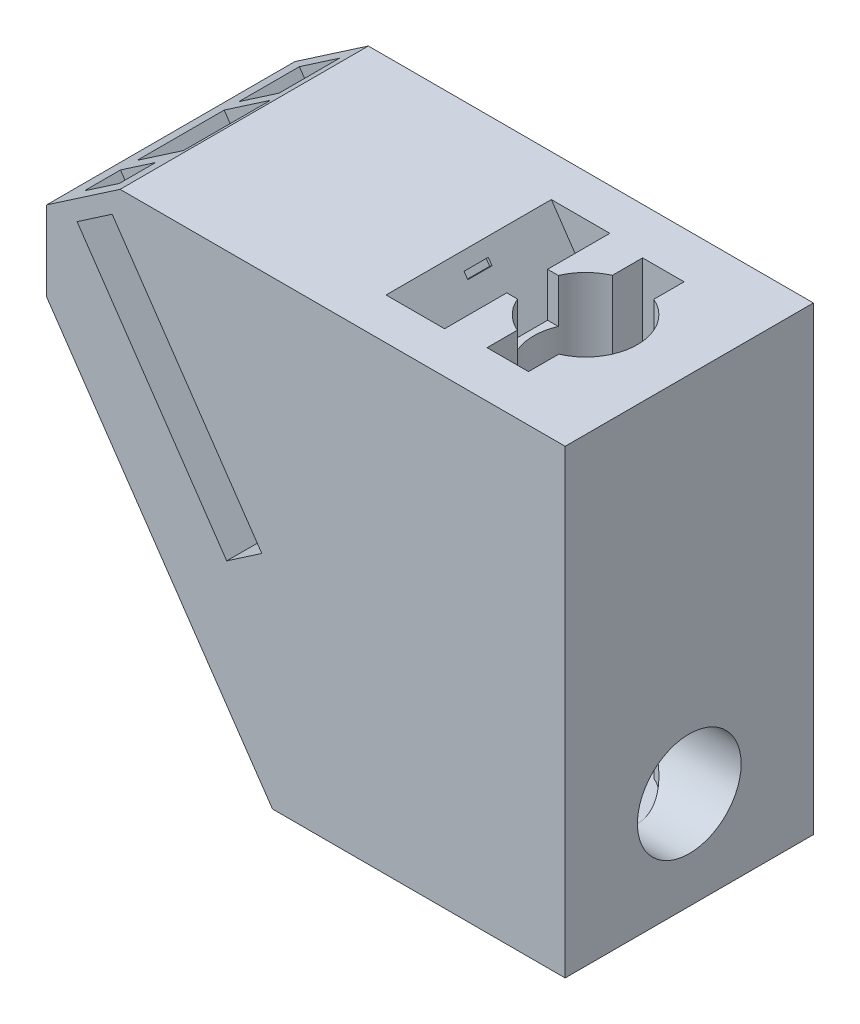
from build123d import *
from build123d.topology import SkipClean

# Parameters (mm, degrees)
BOSS_EXTRUDE1_DEPTH     = 2.5
BOSS_EXTRUDE1_2_DEPTH   = 2.5
BOSS_EXTRUDE2_DEPTH     = 6.35
BOSS_EXTRUDE3_DEPTH     = 6.35
SKETCH4_R               = 3.175
CUT_EXTRUDE1_DEPTH      = 25.4
SKETCH5_R               = 1.5875
CUT_EXTRUDE2_DEPTH      = 25.4
CUT_EXTRUDE3_DEPTH      = 25.4
CUT_EXTRUDE4_REACH      = 43
CUT_EXTRUDE4_END_RADIUS = 3.175
CUT_EXTRUDE5_REACH      = 39.36
SKETCH8_W               = 2.54
SKETCH8_H               = 9.525
SKETCH9_W               = 0.508
SKETCH9_H               = 15.2
BOSS_EXTRUDE4_DEPTH     = 17
BOSS_EXTRUDE5_DEPTH     = 1.016
SKETCH11_W              = 1.176658287
SKETCH11_H              = 2.5
SKETCH11_W_2            = 2.433787944
SKETCH11_H_2            = 15.2
BOSS_EXTRUDE6_DEPTH     = 1.27
CUT_EXTRUDE6_DEPTH      = 38.864332241
BOSS_EXTRUDE7_START     = 2.54
BOSS_EXTRUDE7_DEPTH     = 2.54
BOSS_EXTRUDE8_DEPTH     = 2.54
BOSS_EXTRUDE9_DEPTH     = 0.508
BOSS_EXTRUDE10_DEPTH    = 0.508
CUT_EXTRUDE7_DEPTH      = 3.81
CUT_EXTRUDE8_DEPTH      = 3.81
BOSS_EXTRUDE11_DEPTH    = 3.81
SKETCH21_W              = 1.016
SKETCH21_H              = 1.016
SKETCH21_W_2            = 0.889
BOSS_EXTRUDE12_DEPTH    = 3.302
BOSS_EXTRUDE13_DEPTH    = 3.81


with BuildPart() as part:
    # Sketch1 → Boss-Extrude1 (new body)
    with BuildSketch(Plane.XY):
        Polygon((5.08, 0), (0, 0), (0, 19.141079028), (-1.033059908, 19.141079028), (-3.75575709, 23.125698967), (-8.376397661, 9.077684872), (-11.679025045, 6.820994294), (-21.26996, 20.857160675), (-22.86, 19.770683798), (-22.86, -3.81), (8.89, -3.81), (8.89, 24.384), (5.08, 24.384), align=None)
    extrude(amount=BOSS_EXTRUDE1_DEPTH)



with BuildPart() as body_2:
    # Sketch1 → Boss-Extrude1 2 (new body)
    with BuildSketch(Plane.XY):
        Polygon((-10.069369191, 23.749), (-4.328956497, 23.964566322), (-4.615556201, 24.384), (-16.108492032, 24.384), (-17.03780348, 23.749), align=None)
    extrude(amount=BOSS_EXTRUDE1_2_DEPTH)


with BuildPart() as part_1:
    add(part.part)

    add(body_2.part)  # Boss-Extrude2 merges body 2
    # Sketch2 → Boss-Extrude2 (add)
    with BuildSketch(Plane.XY.offset(2.5)):
        Polygon((-11.679025045, 6.820994294), (-21.26996, 20.857160675), (-22.86, 19.770683798), (-22.86, -3.81), (8.89, -3.81), (8.89, 24.384), (5.08, 24.384), (5.08, 0), (0, 0), (0, 19.141079028), (-1.033059908, 19.141079028), (-3.75575709, 23.125698967), (-8.376397661, 9.077684872), align=None)
        Polygon((-16.108492032, 24.384), (-18.00931945, 23.085161582), (-8.418384495, 9.048995201), (-8.376397661, 9.077684872), (-3.75575709, 23.125698967), (-1.033059908, 19.141079028), (0, 19.141079028), (0, 0), (5.08, 0), (5.08, 24.384), align=None)
    extrude(amount=BOSS_EXTRUDE2_DEPTH)

    # Sketch3 → Boss-Extrude3 (add)
    with BuildSketch(Plane(origin=(0, 0, 0), x_dir=(-1, 0, 0), z_dir=(0, 0, -1))):
        Polygon((-8.89, 24.384), (-8.89, -3.81), (22.86, -3.81), (22.86, 19.770683798), (21.26996, 20.857160675), (11.679025045, 6.820994294), (8.376397661, 9.077684872), (18.00931945, 23.085161582), (16.108492032, 24.384), align=None)
    extrude(amount=BOSS_EXTRUDE3_DEPTH)

    # Sketch4 → Cut-Extrude1 (cut)
    with BuildSketch(Plane(origin=(0, 24.384, 0), x_dir=(1, 0, 0), z_dir=(0, 1, 0))):
        with Locations(Location((2.54, -1.25, 0), (0, 0, 270))):
            Circle(SKETCH4_R)
    extrude(amount=-CUT_EXTRUDE1_DEPTH, mode=Mode.SUBTRACT)

    # Sketch5 → Cut-Extrude2 (cut)
    with BuildSketch(Plane(origin=(0, -1.016, 0), x_dir=(1, 0, 0), z_dir=(0, 1, 0))):
        with Locations(Location((2.54, -1.25, 0), (0, 0, 270))):
            Circle(SKETCH5_R)
    extrude(amount=-CUT_EXTRUDE2_DEPTH, mode=Mode.SUBTRACT)

    # Sketch6 → Cut-Extrude3 (cut)
    with BuildSketch(Plane.XY.offset(8.85)):
        Polygon((-22.86, 16.430904611), (-9.029357481, -3.81), (-22.86, -3.81), align=None)
    extrude(amount=-CUT_EXTRUDE3_DEPTH, mode=Mode.SUBTRACT)

    # Cut-Extrude4: up to this cylinder (the profile starts outside it)
    with SkipClean():  # the faces are left unmerged after this step: merging them gives an invalid solid
        cut_extrude4_end = Plane(origin=(2.54, 2.159, 1.25), z_dir=(0, 1, 0)) * Cylinder(CUT_EXTRUDE4_END_RADIUS, 96.045024, mode=Mode.PRIVATE)
        # Sketch7 → Cut-Extrude4 (cut, up to the surface)
        with BuildSketch(Plane(origin=(8.89, 0, 0), x_dir=(0, 0, -1), z_dir=(1, 0, 0)), mode=Mode.PRIVATE) as cut_extrude4_sk1:
            with BuildLine():
                ThreePointArc((1.925, 2.159), (-1.25, 5.334), (-4.425, 2.159))
                Line((-4.425, 2.159), (1.925, 2.159))
            make_face()
        cut_extrude4_tool1 = extrude(cut_extrude4_sk1.sketch, amount=-CUT_EXTRUDE4_REACH, mode=Mode.PRIVATE) - cut_extrude4_end
        add(cut_extrude4_tool1.solids().sort_by_distance((8.89, 3.506512, 1.25))[0], mode=Mode.SUBTRACT)
        # Sketch7 → Cut-Extrude4 (cut, up to the surface)
        with BuildSketch(Plane(origin=(8.89, 0, 0), x_dir=(0, 0, -1), z_dir=(1, 0, 0)), mode=Mode.PRIVATE) as cut_extrude4_sk2:
            with BuildLine():
                Line((1.925, 2.159), (-4.425, 2.159))
                ThreePointArc((-4.425, 2.159), (-3.49506403, -0.08606403), (-1.25, -1.016))
                ThreePointArc((-1.25, -1.016), (0.99506403, -0.08606403), (1.925, 2.159))
            make_face()
        cut_extrude4_tool2 = extrude(cut_extrude4_sk2.sketch, amount=-CUT_EXTRUDE4_REACH, mode=Mode.PRIVATE) - cut_extrude4_end
        add(cut_extrude4_tool2.solids().sort_by_distance((8.89, 0.811488, 1.25))[0], mode=Mode.SUBTRACT)
        # Sketch7 → Cut-Extrude4 (cut, up to the surface)
        with BuildSketch(Plane(origin=(8.89, 0, 0), x_dir=(0, 0, -1), z_dir=(1, 0, 0)), mode=Mode.PRIVATE) as cut_extrude4_sk3:
            with BuildLine():
                ThreePointArc((1.925, 2.159), (-1.25, 5.334), (-4.425, 2.159))
                Line((-4.425, 2.159), (1.925, 2.159))
            make_face()
        cut_extrude4_tool3 = extrude(cut_extrude4_sk3.sketch, amount=-CUT_EXTRUDE4_REACH, mode=Mode.PRIVATE) - cut_extrude4_end
        add(cut_extrude4_tool3.solids().sort_by_distance((8.89, 3.506512, 1.25))[0], mode=Mode.SUBTRACT)
        # Sketch7 → Cut-Extrude4 (cut, up to the surface)
        with BuildSketch(Plane(origin=(8.89, 0, 0), x_dir=(0, 0, -1), z_dir=(1, 0, 0)), mode=Mode.PRIVATE) as cut_extrude4_sk4:
            with BuildLine():
                Line((1.925, 2.159), (-4.425, 2.159))
                ThreePointArc((-4.425, 2.159), (-3.49506403, -0.08606403), (-1.25, -1.016))
                ThreePointArc((-1.25, -1.016), (0.99506403, -0.08606403), (1.925, 2.159))
            make_face()
        cut_extrude4_tool4 = extrude(cut_extrude4_sk4.sketch, amount=-CUT_EXTRUDE4_REACH, mode=Mode.PRIVATE) - cut_extrude4_end
        add(cut_extrude4_tool4.solids().sort_by_distance((8.89, 0.811488, 1.25))[0], mode=Mode.SUBTRACT)

    # Cut-Extrude5: up to this face of the body (flat: up to its plane)
    cut_extrude5_end = Plane(part_1.part.faces().sort_by_distance((4.72156403, -1.016, 3.43156403))[0])
    # Sketch8 → Cut-Extrude5 (cut, up to the picked face)
    with BuildSketch(Plane(origin=(0, 24.384, 0), x_dir=(1, 0, 0), z_dir=(0, 1, 0)), mode=Mode.PRIVATE) as cut_extrude5_sk1:
        with Locations((2.54, -1.25)):
            Rectangle(SKETCH8_W, SKETCH8_H)
    cut_extrude5_tool1 = split(extrude(cut_extrude5_sk1.sketch, amount=-CUT_EXTRUDE5_REACH, mode=Mode.PRIVATE), bisect_by=cut_extrude5_end, keep=Keep.BOTH, mode=Mode.PRIVATE)
    add(cut_extrude5_tool1.solids().sort_by(Axis((2.54, 24.384, 1.25), (0, -1, 0)))[0], mode=Mode.SUBTRACT)

    # Sketch9 → Boss-Extrude4 (add)
    with BuildSketch(Plane(origin=(-6.894633763, 10.090176515, 0), x_dir=(0.825656845959394, 0.5641726444275594, 0), z_dir=(-0.5641726444275594, 0.825656845959394, 0))):
        with Locations((-5.540648594, -1.25)):
            Rectangle(SKETCH9_W, SKETCH9_H)
        Polygon((-1.794648594, 6.35), (-2.302648594, 6.35), (-2.302648594, 1.6202), (-3.623501238, 1.6202), (-3.623501238, 0.7312), (-1.794648594, 0.7312), align=None)
        Polygon((-1.845501238, -8.85), (-1.845501238, -4.6028), (-3.572648594, -4.6028), (-3.572648594, -5.6188), (-2.683648594, -5.6188), (-2.683648594, -8.85), align=None)
    extrude(amount=BOSS_EXTRUDE4_DEPTH)

    # Sketch10 → Boss-Extrude5 (add)
    with BuildSketch(Plane(origin=(-6.894633763, 10.090176515, 0), x_dir=(0.8256568459593948, 0.5641726444275585, 0), z_dir=(-0.5641726444275585, 0.8256568459593948, 0))):
        Polygon((-5.286648594, -8.85), (-2.683648594, -8.85), (-2.683648594, -5.6188), (-3.572648594, -5.6188), (-3.572648594, -4.6028), (-1.845501238, -4.6028), (-1.845501238, -2.5), (-1.794648594, -2.5), (-1.794648594, 0), (-1.794648594, 0.7312), (-3.623501238, 0.7312), (-3.623501238, 1.6202), (-2.302648594, 1.6202), (-2.302648594, 6.35), (-5.286648594, 6.35), align=None)
    extrude(amount=BOSS_EXTRUDE5_DEPTH)

    # Sketch11 → Boss-Extrude6 (add)
    with BuildSketch(Plane(origin=(-16.485568719, 24.126342896, 0), x_dir=(0.8256568459593935, 0.5641726444275603, 0), z_dir=(-0.5641726444275603, 0.8256568459593935, 0))):
        with Locations((-1.257172095, -1.25)):
            Rectangle(SKETCH11_W, SKETCH11_H)
        Polygon((-3.623501238, 1.6202), (-3.623501238, 0.7312), (-1.845501238, 0.7312), (-1.845501238, 0), (-0.668842951, 0), (-0.668842951, -2.5), (-1.845501238, -2.5), (-1.845501238, -4.6028), (-3.572648594, -4.6028), (-3.572648594, -5.6188), (-2.683648594, -5.6188), (-2.683648594, -8.85), (0.456699038, -8.85), (0.456699038, 6.35), (-2.302648594, 6.35), (-2.302648594, 1.6202), align=None)
        with Locations((-6.503542566, -1.25)):
            Rectangle(SKETCH11_W_2, SKETCH11_H_2)
    extrude(amount=BOSS_EXTRUDE6_DEPTH)

    # Sketch12 → Cut-Extrude6 (cut, through all)
    with BuildSketch(Plane.XY.offset(8.85)):
        Polygon((-16.108492032, 24.384), (-18.359576008, 24.384), (-16.82499129, 25.432584194), align=None)
        Polygon((-22.86, 19.770683798), (-22.86, 21.308853083), (-23.576499258, 20.819267993), align=None)
    extrude(amount=-CUT_EXTRUDE6_DEPTH, mode=Mode.SUBTRACT)

    # Sketch13 → Boss-Extrude7 (add)
    with BuildSketch(Plane(origin=(0, 19.141079028, 0), x_dir=(1, 0, 0), z_dir=(0, 1, 0)).offset(BOSS_EXTRUDE7_START)):
        with BuildLine():
            Line((-0.378582704, 0), (-1.033059908, 0))
            Line((-1.033059908, 0), (-1.033059908, -2.5))
            Line((-1.033059908, -2.5), (-0.378582704, -2.5))
            ThreePointArc((-0.378582704, -2.5), (-0.635, -1.25), (-0.378582704, 0))
        make_face()
    extrude(amount=-BOSS_EXTRUDE7_DEPTH)

    # Sketch15 → Boss-Extrude8 (add)
    with BuildSketch(Plane.XY):
        Polygon((-4.156996675, 23.712906116), (-4.328956497, 23.964566322), (-4.538912798, 23.956681957), (-4.303798462, 23.612596219), align=None)
        Polygon((-3.75575709, 23.125698967), (-3.927716912, 23.377359173), (-4.0745187, 23.277049277), (-3.825732396, 22.912954853), align=None)
    extrude(amount=BOSS_EXTRUDE8_DEPTH)

    # Sketch16 → Boss-Extrude9 (add)
    with BuildSketch(Plane.XY):
        Polygon((-4.0745187, 23.277049277), (-4.303798462, 23.612596219), (-4.156996675, 23.712906116), (-3.927716912, 23.377359173), align=None)
    extrude(amount=BOSS_EXTRUDE9_DEPTH)

    # Sketch17 → Boss-Extrude10 (add)
    with BuildSketch(Plane(origin=(0, 0, 2.5), x_dir=(-1, 0, 0), z_dir=(0, 0, -1))):
        Polygon((4.0745187, 23.277049277), (4.303798462, 23.612596219), (4.156996675, 23.712906116), (3.927716912, 23.377359173), align=None)
    extrude(amount=BOSS_EXTRUDE10_DEPTH)

    # Sketch18 → Cut-Extrude7 (cut)
    with BuildSketch(Plane(origin=(0, 0, 2.5), x_dir=(-1, 0, 0), z_dir=(0, 0, -1))):
        Polygon((1.033059908, 24.384), (1.033059908, 21.681079028), (1.033059908, 19.141079028), (4.615556201, 24.384), align=None)
    extrude(amount=-CUT_EXTRUDE7_DEPTH, mode=Mode.SUBTRACT)

    # Sketch19 → Cut-Extrude8 (cut)
    with BuildSketch(Plane.XY):
        Polygon((-1.033059908, 19.141079028), (-1.033059908, 21.681079028), (-1.033059908, 24.384), (-4.615556201, 24.384), align=None)
    extrude(amount=-CUT_EXTRUDE8_DEPTH, mode=Mode.SUBTRACT)

    # Sketch20 → Boss-Extrude11 (add)
    with BuildSketch(Plane.XY):
        Polygon((-10.069369191, 23.749), (-4.303798462, 23.612596219), (-4.538912798, 23.956681957), align=None)
    extrude(amount=BOSS_EXTRUDE11_DEPTH)

    # Sketch21 → Boss-Extrude12 (add)
    with BuildSketch(Plane(origin=(-4.364957604, -2.982582517, 0), x_dir=(0, 0, -1), z_dir=(0.8256568459593941, 0.5641726444275595, 0))):
        with Locations((5.842, 29.982787079)):
            Rectangle(SKETCH21_W, SKETCH21_H)
        with Locations((1.1757, 29.982787079)):
            Rectangle(SKETCH21_W_2, SKETCH21_H)
        with Locations((-5.1108, 29.982787079)):
            Rectangle(SKETCH21_W, SKETCH21_H)
        with Locations((-8.342, 29.982787079)):
            Rectangle(SKETCH21_W, SKETCH21_H)
    extrude(amount=BOSS_EXTRUDE12_DEPTH)

    # Sketch22 → Boss-Extrude13 (add)
    with BuildSketch(Plane.XY):
        Polygon((-3.825732396, 22.912954853), (-4.0745187, 23.277049277), (-4.222544103, 21.706538478), align=None)
    extrude(amount=BOSS_EXTRUDE13_DEPTH)


solid = part_1.part
